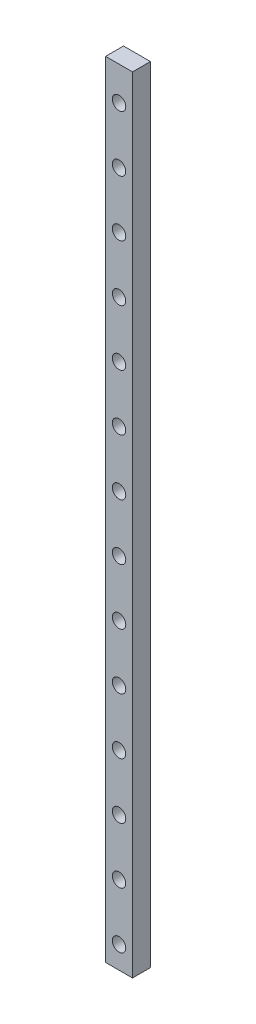
from build123d import *

# Parameters (mm, degrees)
SKETCH_1_W             = 12
SKETCH_1_H             = 8
EXTRUDE_1_DEPTH        = 350
SKETCH_2_R             = 3
CUT_EXTRUDE_1_DEPTH    = 4.5
SKETCH_3_R             = 1.75
CUT_EXTRUDE_2_DEPTH    = 4.5
PATTERN_LINEAR_1_COUNT = 14
PATTERN_LINEAR_1_PITCH = 25


with BuildPart() as part:
    # 草图1 → 凸台-拉伸1 (new body)
    with BuildSketch(Plane(origin=(0, 0, 0), x_dir=(1, 0, 0), z_dir=(0, 1, 0))):
        Rectangle(SKETCH_1_W, SKETCH_1_H)
    extrude(amount=EXTRUDE_1_DEPTH)

    # 草图2 → 切除-拉伸1 (cut)
    with BuildSketch(Plane.XY.offset(4)):
        with Locations((0, 10)):
            Circle(SKETCH_2_R)
    cut_extrude_1 = extrude(amount=-CUT_EXTRUDE_1_DEPTH, mode=Mode.SUBTRACT)

    # 草图3 → 切除-拉伸2 (cut)
    with BuildSketch(Plane.XY.offset(-0.5)):
        with Locations((0, 10)):
            Circle(SKETCH_3_R)
    cut_extrude_2 = extrude(amount=-CUT_EXTRUDE_2_DEPTH, mode=Mode.SUBTRACT)

    # 阵列(线性)1: 切除-拉伸1, 切除-拉伸2 ×14
    with Locations(*[(0, i * PATTERN_LINEAR_1_PITCH, 0) for i in range(1, PATTERN_LINEAR_1_COUNT)]):
        add(cut_extrude_1, mode=Mode.SUBTRACT)
        add(cut_extrude_2, mode=Mode.SUBTRACT)


solid = part.part
